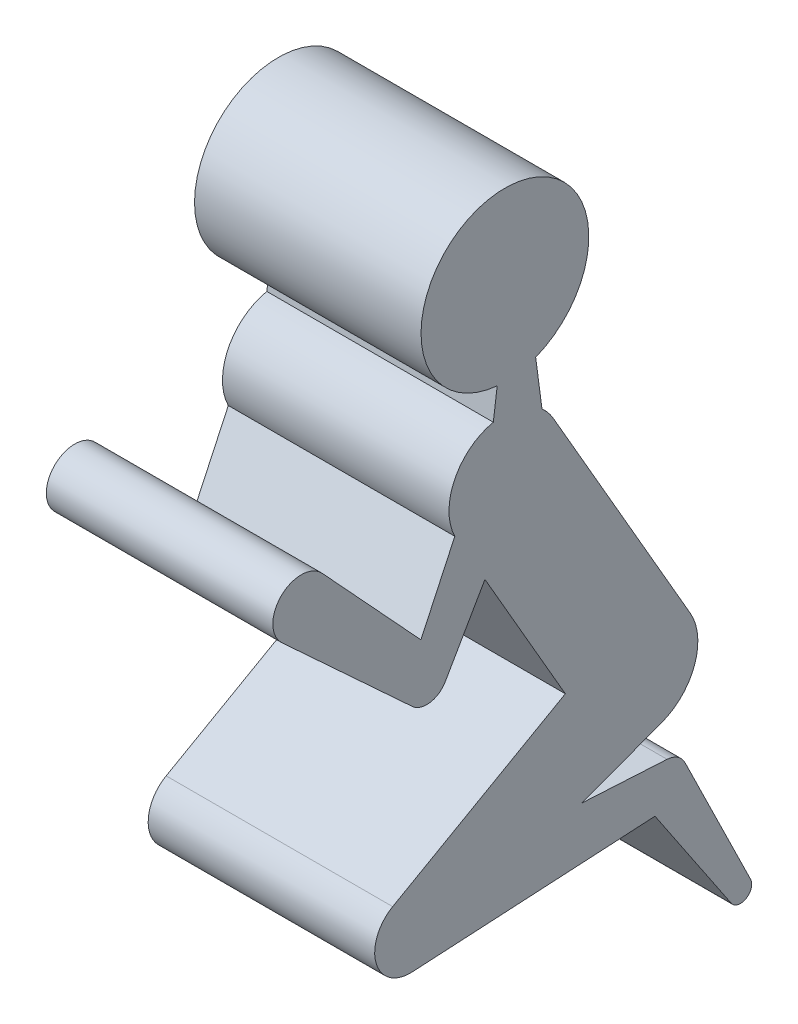
from build123d import *

# Parameters (mm, degrees)
SKETCH2_R           = 150
SKETCH2_R_2         = 100
SKETCH2_R_3         = 38.1
SKETCH2_R_4         = 50.8
SKETCH2_R_5         = 63.5
SKETCH2_R_6         = 20
BOSS_EXTRUDE1_DEPTH = 202.5


with BuildPart() as part:
    # Sketch2 → Boss-Extrude1 (new, symmetric)
    with BuildSketch(Plane(origin=(0, 0, 0), x_dir=(0, 0, -1), z_dir=(1, 0, 0))):
        with Locations((169.380920233, 917.544072258)):
            Circle(SKETCH2_R)
        with BuildLine():
            ThreePointArc((148.612903403, 715.363750631), (194.853343441, 714.245445857), (235.644139642, 692.438569744))
            Line((235.644139642, 692.438569744), (224.380920233, 777.991214889))
            ThreePointArc((224.380920233, 777.991214889), (190.549773257, 769.045319194), (155.566499173, 768.1815543))
            Line((155.566499173, 768.1815543), (148.612903403, 715.363750631))
        make_face()
        with Locations((169.380920233, 617.544072258)):
            Circle(SKETCH2_R_2)
        with BuildLine():
            Line((133.64293857, 479.444072258), (156.147736241, 518.423525239))
            ThreePointArc((156.147736241, 518.423525239), (113.74819605, 534.447742616), (82.778379855, 567.544072258))
            Line((82.778379855, 567.544072258), (133.64293857, 479.444072258))
        make_face()
        with BuildLine():
            Line((62.676488117, 356.526574441), (133.64293857, 479.444072258))
            Line((133.64293857, 479.444072258), (82.778379855, 567.544072258))
            ThreePointArc((82.778379855, 567.544072258), (81.231422133, 570.324733162), (79.773717129, 573.15320437))
            Line((79.773717129, 573.15320437), (19.154340526, 443.154531728))
            Line((19.154340526, 443.154531728), (57.677758088, 401.418150827))
            ThreePointArc((57.677758088, 401.418150827), (65.165350074, 389.449758606), (67.780920233, 375.576574441))
            ThreePointArc((67.780920233, 375.576574441), (66.482694215, 365.715568823), (62.676488117, 356.526574441))
        make_face()
        with Locations((29.680920233, 375.576574441)):
            Circle(SKETCH2_R_3)
        with BuildLine():
            Line((57.677758088, 401.418150827), (19.154340526, 443.154531728))
            Line((19.154340526, 443.154531728), (-4.849406453, 391.678330213))
            ThreePointArc((-4.849406453, 391.678330213), (23.816822223, 413.222588234), (57.677758088, 401.418150827))
        make_face()
        with BuildLine():
            Line((-4.849406453, 391.678330213), (19.154340526, 443.154531728))
            Line((19.154340526, 443.154531728), (-157.496365653, 634.538412649))
            ThreePointArc((-157.496365653, 634.538412649), (-147.512909672, 618.580556354), (-144.025482794, 600.082977468))
            ThreePointArc((-144.025482794, 600.082977468), (-174.45020497, 553.548172713), (-229.280917975, 562.753860328))
            Line((-229.280917975, 562.753860328), (3.839343847, 347.579736586))
            ThreePointArc((3.839343847, 347.579736586), (-7.700400772, 368.211329036), (-4.849406453, 391.678330213))
        make_face()
        with Locations((-194.825482794, 600.082977468)):
            Circle(SKETCH2_R_4)
        with BuildLine():
            ThreePointArc((365.001588936, 280.188650866), (440.600513293, 289.717914732), (500.966460612, 243.221069268))
            Line((500.966460612, 243.221069268), (255.983460612, 667.544072258))
            ThreePointArc((255.983460612, 667.544072258), (265.973502862, 643.425976769), (269.380920233, 617.544072258))
            ThreePointArc((269.380920233, 617.544072258), (235.247002555, 542.300074494), (156.147736241, 518.423525239))
            Line((156.147736241, 518.423525239), (133.64293857, 479.444072258))
            Line((133.64293857, 479.444072258), (277.392641257, 230.462283632))
            Line((277.392641257, 230.462283632), (365.001588936, 280.188650866))
        make_face()
        with BuildLine():
            ThreePointArc((327.761379855, 143.221069268), (317.867074769, 219.457662328), (365.001588936, 280.188650866))
            Line((365.001588936, 280.188650866), (277.392641257, 230.462283632))
            Line((277.392641257, 230.462283632), (327.761379855, 143.221069268))
        make_face()
        with Locations((414.363920233, 193.221069268)):
            Circle(SKETCH2_R_2)
        with BuildLine():
            Line((306.939939608, 46.519626158), (449.255457905, 99.505645783))
            ThreePointArc((449.255457905, 99.505645783), (380.507362333, 99.126789489), (327.761379855, 143.221069268))
            Line((327.761379855, 143.221069268), (277.392641257, 230.462283632))
            Line((277.392641257, 230.462283632), (-31.345080373, 55.224414315))
            ThreePointArc((-31.345080373, 55.224414315), (-14.497190191, 61.822985018), (3.527777778, 63.401930443))
            Line((3.527777778, 63.401930443), (306.939939608, 46.519626158))
        make_face()
        Circle(SKETCH2_R_5)
        with BuildLine():
            Line((22.156126422, -59.509293913), (306.939939608, 46.519626158))
            Line((306.939939608, 46.519626158), (3.527777778, 63.401930443))
            ThreePointArc((3.527777778, 63.401930443), (46.131680486, 43.636201204), (63.5, 0))
            ThreePointArc((63.5, 0), (52.149611829, -36.23076022), (22.156126422, -59.509293913))
        make_face()
        with BuildLine():
            Line((459.316666667, 38.041158266), (306.939939608, 46.519626158))
            Line((306.939939608, 46.519626158), (22.156126422, -59.509293913))
            ThreePointArc((22.156126422, -59.509293913), (12.988606104, -62.157430059), (3.527777778, -63.401930443))
            Line((3.527777778, -63.401930443), (437.66530145, -39.245872453))
            Line((437.66530145, -39.245872453), (425.573363507, -21.24537277))
            ThreePointArc((425.573363507, -21.24537277), (424.087573777, 18.846146281), (459.316666667, 38.041158266))
        make_face()
        with Locations((457.2, 0)):
            Circle(SKETCH2_R_3)
        with BuildLine():
            Line((608.509239254, -222.167513639), (491.412350778, 16.766784254))
            ThreePointArc((491.412350778, 16.766784254), (494.315364505, 8.605795586), (495.3, 0))
            ThreePointArc((495.3, 0), (484.879008291, -26.181720723), (459.316666667, -38.041158266))
            Line((459.316666667, -38.041158266), (437.66530145, -39.245872453))
            Line((437.66530145, -39.245872453), (573.94809108, -242.12140184))
            ThreePointArc((573.94809108, -242.12140184), (580.55, -213.648467114), (608.509239254, -222.167513639))
        make_face()
        with Locations((590.55, -230.968975189)):
            Circle(SKETCH2_R_6)
        with BuildLine():
            ThreePointArc((459.316666667, -38.041158266), (440.222538989, -34.108295437), (425.573363507, -21.24537277))
            Line((425.573363507, -21.24537277), (437.66530145, -39.245872453))
            Line((437.66530145, -39.245872453), (459.316666667, -38.041158266))
        make_face()
    extrude(amount=BOSS_EXTRUDE1_DEPTH, both=True)


solid = part.part
